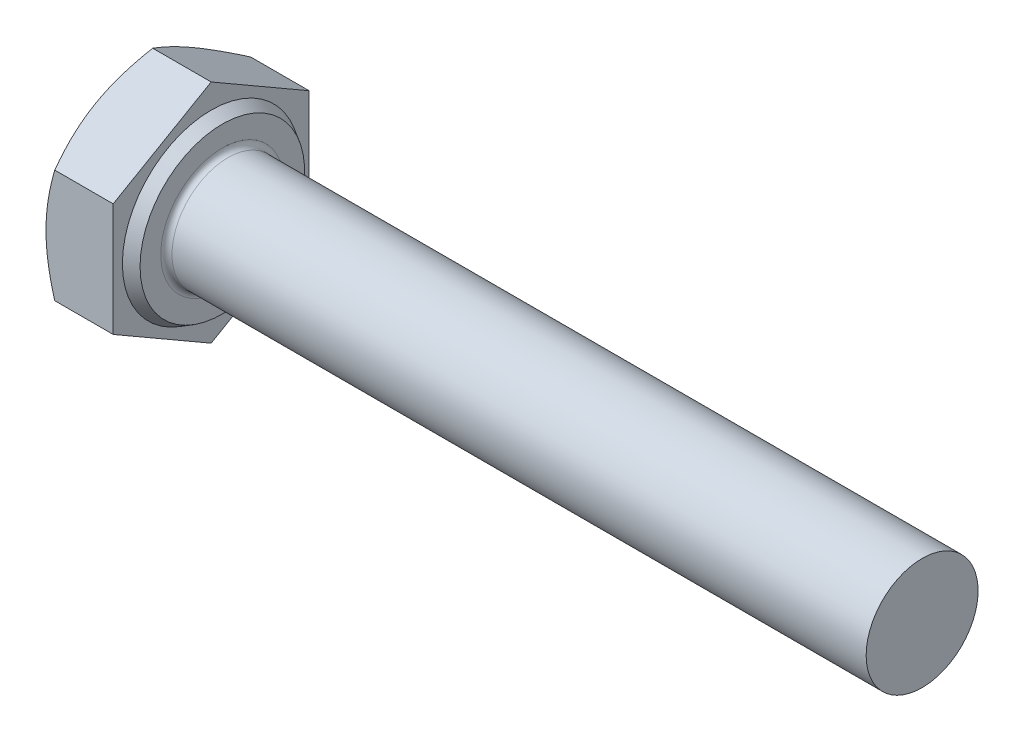
from build123d import *

# Parameters (mm, degrees)
EXTRUDE_384_DEPTH = 2.8
FILLET_1305_R     = 0.2


with BuildPart() as part:
    # 草图1 → Extrude 384 (new body)
    with BuildSketch(Plane(origin=(0, 0, 0), x_dir=(0, 0, -1), z_dir=(1, 0, 0))):
        Polygon((3.5, 2.020725942), (3.5, -2.020725942), (0, -4.041451884), (-3.5, -2.020725942), (-3.5, 2.020725942), (0, 4.041451884), align=None)
    extrude(amount=EXTRUDE_384_DEPTH)

    # 草图2 → 凸台-旋转1 (revolve)
    with BuildSketch(Plane.XY, mode=Mode.PRIVATE) as revolve_1_sk:
        Polygon((0, 0), (27.8, 0), (27.8, 1.3938), (27.8, 2), (13.8, 2), (0, 2), align=None)
    revolve(revolve_1_sk.sketch.rotate(Axis((0, 0, 0), (1, 0, 0)), 90), axis=Axis((0, 0, 0), (1, 0, 0)))

    # 草图3 → 切除-旋转1 (revolve, cut)
    with BuildSketch(Plane.XY):
        Polygon((0, 3.5), (3.199358737, 9.041451884), (3.199358737, 14.041451884), (-10, 14.041451884), (-10, 3.5), align=None)
    revolve(axis=Axis((0, 0, 0), (1, 0, 0)), mode=Mode.SUBTRACT)

    # 草图4 → 切除-旋转3 (revolve, cut)
    with BuildSketch(Plane.XY, mode=Mode.PRIVATE) as cut_revolve_3_sk:
        Polygon((2.8, 2.94), (2.4, 3.170940108), (2.4, 4.041451884), (2.8, 4.041451884), align=None)
    revolve(cut_revolve_3_sk.sketch.rotate(Axis((0, 0, 0), (1, 0, 0)), 90), axis=Axis((0, 0, 0), (1, 0, 0)), mode=Mode.SUBTRACT)

    # Fillet 1305
    fillet_1305_edges = [part.edges().sort_by_distance(p)[0] for p in [
        (2.8, 0, -2),
    ]]
    fillet(fillet_1305_edges, radius=FILLET_1305_R)


solid = part.part
